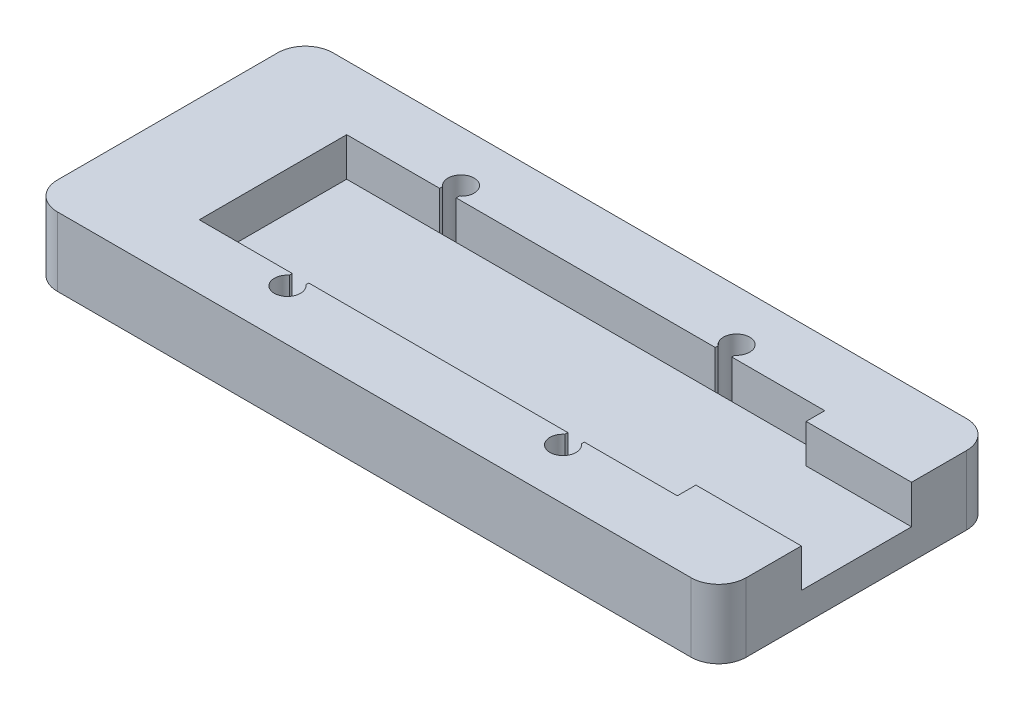
from build123d import *

# Parameters (mm, degrees)
EXTRUDE_1_DEPTH     = 5
CUT_EXTRUDE_1_DEPTH = 2.8
CUT_EXTRUDE_2_DEPTH = 5


with BuildPart() as part:
    # 草圖1 → 填料-伸長1 (new body)
    with BuildSketch(Plane(origin=(0, 0, 0), x_dir=(1, 0, 0), z_dir=(0, 1, 0))):
        with BuildLine():
            Line((-23, -10), (23, -10))
            ThreePointArc((23, -10), (24.414213562, -9.414213562), (25, -8))
            Line((25, -8), (25, 8))
            ThreePointArc((25, 8), (24.414213562, 9.414213562), (23, 10))
            Line((23, 10), (-23, 10))
            ThreePointArc((-23, 10), (-24.414213562, 9.414213562), (-25, 8))
            Line((-25, 8), (-25, -8))
            ThreePointArc((-25, -8), (-24.414213562, -9.414213562), (-23, -10))
        make_face()
    extrude(amount=EXTRUDE_1_DEPTH)

    # 草圖2 → 除料-伸長1 (cut)
    with BuildSketch(Plane(origin=(0, 5, 0), x_dir=(1, 0, 0), z_dir=(0, 1, 0))):
        Polygon((-17.35, -5.35), (17.35, -5.35), (17.35, -4), (25, -4), (25, 4), (17.35, 4), (17.35, 5.35), (-17.35, 5.35), align=None)
    extrude(amount=-CUT_EXTRUDE_1_DEPTH, mode=Mode.SUBTRACT)

    # 草圖3 → 除料-伸長2 (cut)
    with BuildSketch(Plane(origin=(0, 5, 0), x_dir=(1, 0, 0), z_dir=(0, 1, 0))):
        with BuildLine():
            Line((-10.6, 5.563454007), (-10.6, 5.35))
            Line((-10.6, 5.35), (-9.4, 5.35))
            Line((-9.4, 5.35), (-9.4, 5.563454007))
            ThreePointArc((-9.4, 5.563454007), (-10, 7.25), (-10.6, 5.563454007))
        make_face()
        with BuildLine():
            Line((-10.6, -5.35), (-9.4, -5.35))
            Line((-9.4, -5.35), (-9.4, -5.563454007))
            ThreePointArc((-9.4, -5.563454007), (-10, -7.25), (-10.6, -5.563454007))
            Line((-10.6, -5.563454007), (-10.6, -5.35))
        make_face()
        with BuildLine():
            Line((10.6, 5.563454007), (10.6, 5.35))
            Line((10.6, 5.35), (9.4, 5.35))
            Line((9.4, 5.35), (9.4, 5.563454007))
            ThreePointArc((9.4, 5.563454007), (10, 7.25), (10.6, 5.563454007))
        make_face()
        with BuildLine():
            Line((9.4, -5.563454007), (9.4, -5.35))
            Line((9.4, -5.35), (10.6, -5.35))
            Line((10.6, -5.35), (10.6, -5.563454007))
            ThreePointArc((10.6, -5.563454007), (10, -7.25), (9.4, -5.563454007))
        make_face()
    extrude(amount=-CUT_EXTRUDE_2_DEPTH, mode=Mode.SUBTRACT)


solid = part.part
